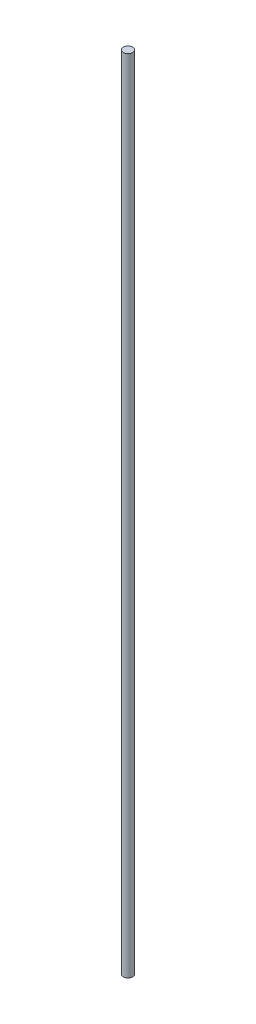
from build123d import *

# Parameters (mm, degrees)
BOSS_EXTRUDE1_DEPTH      = 128
BOSS_EXTRUDE1_DEPTH_BACK = 128
SKETCH1_R                = 1.5


with BuildPart() as part:
    # Sketch1 → Boss-Extrude1 (new, two sides: drawn at the far end of the back side and taken through both)
    with BuildSketch(Plane(origin=(0, 0, 0), x_dir=(1, 0, 0), z_dir=(0, 1, 0)).offset(-BOSS_EXTRUDE1_DEPTH_BACK)):
        Circle(SKETCH1_R)
    extrude(amount=BOSS_EXTRUDE1_DEPTH + BOSS_EXTRUDE1_DEPTH_BACK)


solid = part.part
